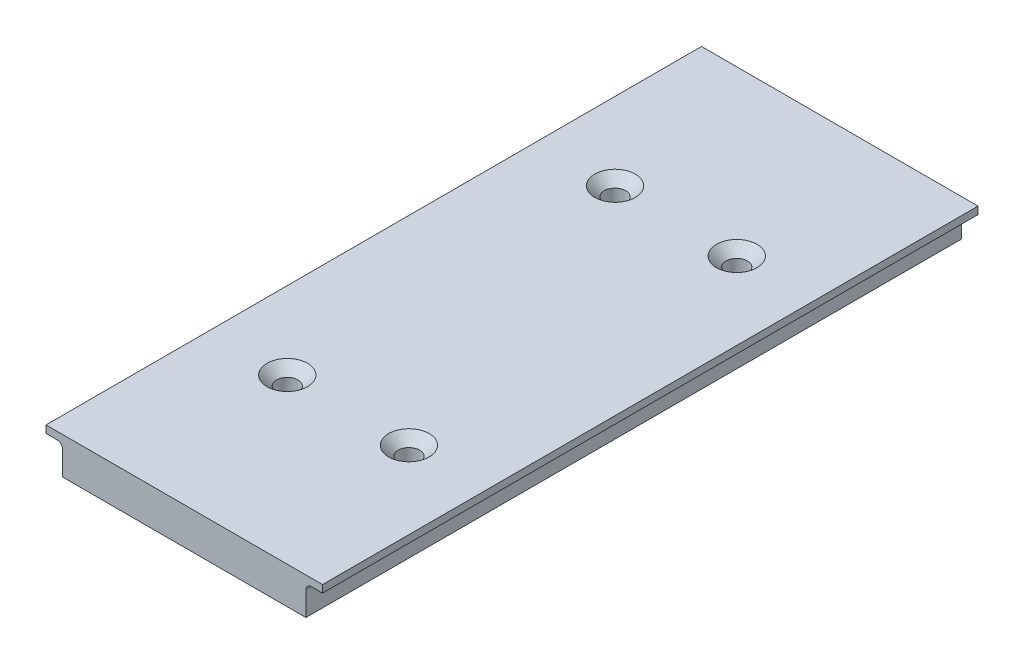
from build123d import *

# Parameters (mm, degrees)
BOSS_EXTRUDE1_DEPTH                               = 88.9
CSK_FOR_M2_5_FLAT_HEAD_MACHINE_SCREW1_D           = 2.9
CSK_FOR_M2_5_FLAT_HEAD_MACHINE_SCREW1_CSINK_D     = 5.5
CSK_FOR_M2_5_FLAT_HEAD_MACHINE_SCREW1_CSINK_ANGLE = 90


with BuildPart() as part:
    # Sketch1 → Boss-Extrude1 (new body)
    with BuildSketch(Plane.XY):
        with BuildLine():
            Line((-16.5, 3.25), (-16.5, 0))
            Line((-16.5, 0), (16.5, 0))
            Line((16.5, 0), (16.5, 3.25))
            ThreePointArc((16.5, 3.25), (16.719669914, 3.780330086), (17.25, 4))
            Line((17.25, 4), (18.75, 4))
            Line((18.75, 4), (18.75, 5))
            Line((18.75, 5), (-18.75, 5))
            Line((-18.75, 5), (-18.75, 4))
            Line((-18.75, 4), (-17.25, 4))
            ThreePointArc((-17.25, 4), (-16.719669914, 3.780330086), (-16.5, 3.25))
        make_face()
    extrude(amount=BOSS_EXTRUDE1_DEPTH)

    # CSK for M2.5 Flat Head Machine Screw1 (through all)
    with Locations(Plane(origin=(0, 5, 0), x_dir=(1, 0, 0), z_dir=(0, 1, 0))):
        with Locations((8.250631971, -22.223297508), (-8.250631971, -22.223297508), (-8.250631971, -66.676702492), (8.250631971, -66.676702492)):
            CounterSinkHole(CSK_FOR_M2_5_FLAT_HEAD_MACHINE_SCREW1_D / 2, CSK_FOR_M2_5_FLAT_HEAD_MACHINE_SCREW1_CSINK_D / 2, counter_sink_angle=CSK_FOR_M2_5_FLAT_HEAD_MACHINE_SCREW1_CSINK_ANGLE)


solid = part.part
